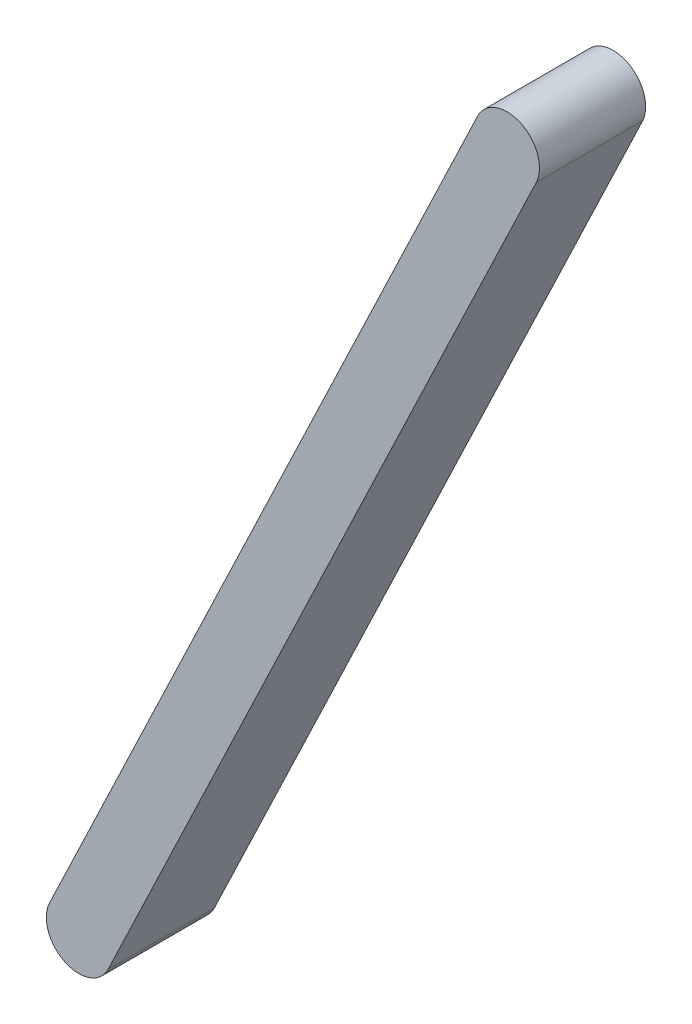
from build123d import *

# Parameters (mm, degrees)
EXTRUDE_1_DEPTH = 2


with BuildPart() as part:
    # 草图1 → 凸台-拉伸1 (new body)
    with BuildSketch(Plane.XY):
        with BuildLine():
            Line((170.26828726, -69.749756499), (178.330367791, -52.886544857))
            ThreePointArc((178.330367791, -52.886544857), (179.147406394, -52.598048184), (179.435903067, -53.415086787))
            Line((179.435903067, -53.415086787), (171.373822536, -70.278298429))
            ThreePointArc((171.373822536, -70.278298429), (170.556783933, -70.566795102), (170.26828726, -69.749756499))
        make_face()
    extrude(amount=EXTRUDE_1_DEPTH)


solid = part.part
